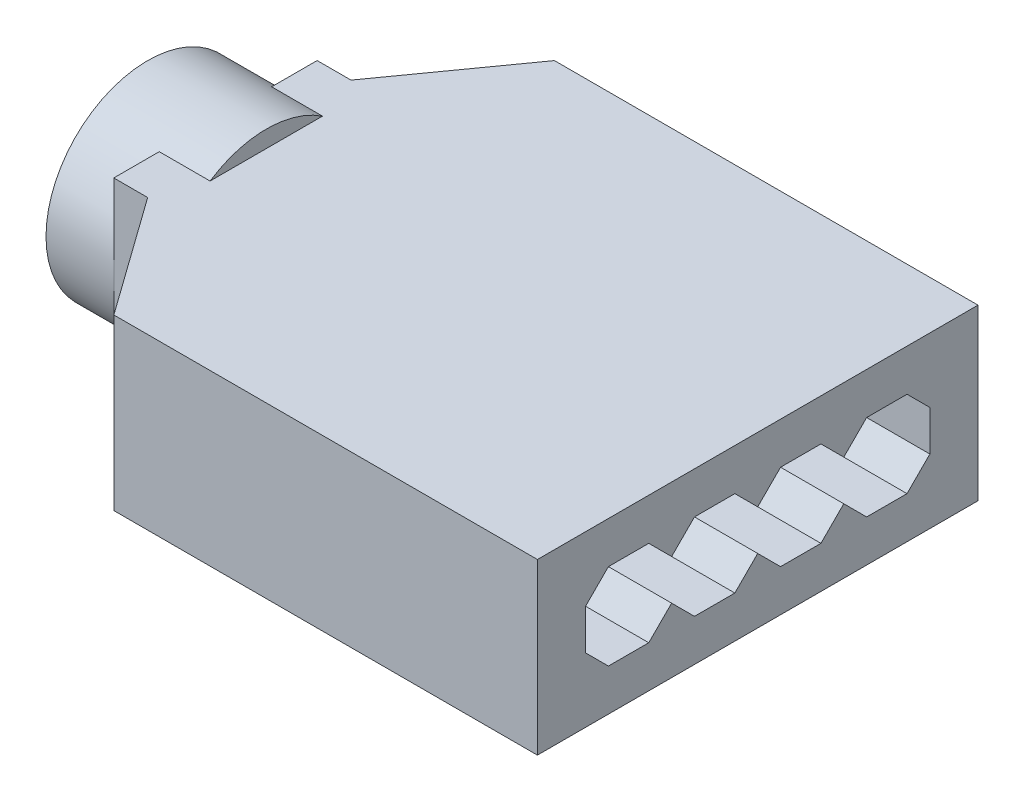
from build123d import *

# Parameters (mm, degrees)
CROQUIS1_W                     = 0.64
CROQUIS1_H                     = 0.64
SALIENTE_EXTRUIR1_DEPTH        = 2.54
SALIENTE_EXTRUIR2_DEPTH        = 8.54
SALIENTE_EXTRUIR2_DEPTH_BACK   = 3
CROQUIS3_W                     = 0.64
CROQUIS3_H                     = 0.64
SALIENTE_EXTRUIR2_2_DEPTH      = 8.54
SALIENTE_EXTRUIR2_2_DEPTH_BACK = 3
CHAFL_N1_SIZE                  = 0.2
CHAFL_N2_SIZE                  = 0.2
CROQUIS1_4_W                   = 11
CROQUIS1_4_H                   = 3
BOSS_EXTRUDE6_DEPTH            = 2.54
SKETCH6_W                      = 11
SKETCH6_H                      = 3
SKETCH6_R                      = 1
BOSS_EXTRUDE11_DEPTH           = 0.8
SKETCH7_W                      = 13
SKETCH7_H                      = 5
SKETCH7_W_2                    = 11
SKETCH7_H_2                    = 3
BOSS_EXTRUDE12_DEPTH           = 15
SKETCH8_W                      = 13
SKETCH8_H                      = 5
SKETCH8_R                      = 2
BOSS_EXTRUDE13_DEPTH           = 1
BOSS_EXTRUDE15_DEPTH           = 2
BOSS_EXTRUDE15_DEPTH_BACK      = 1.5
SKETCH9_R                      = 3
SKETCH9_R_2                    = 2
SKETCH10_W                     = 0.5
SKETCH10_H                     = 1.275200555
CUT_EXTRUDE2_DEPTH             = 3
BOSS_EXTRUDE20_DEPTH           = 3
CUT_EXTRUDE3_DEPTH             = 3
CUT_EXTRUDE5_DEPTH             = 18.878324866
CUT_EXTRUDE5_DEPTH_BACK        = 18.878324866


with BuildPart() as part:
    # Croquis1 → Saliente-Extruir1 (new body)
    # profile 1 of 2: a face of its own
    with BuildSketch(Plane(origin=(0, 0, 0), x_dir=(0, 0, -1), z_dir=(1, 0, 0))):
        Polygon((1.27, 0.595482683), (1.27, -0.595482683), (0.595482683, -1.27), (-0.595482683, -1.27), (-1.27, -0.595482683), (-1.27, 0.595482683), (-0.595482683, 1.27), (0.595482683, 1.27), align=None)
        Rectangle(CROQUIS1_W, CROQUIS1_H, mode=Mode.SUBTRACT)
    # profile 2 of 2: a face of its own
    with BuildSketch(Plane(origin=(0, 0, 0), x_dir=(0, 0, -1), z_dir=(1, 0, 0))):
        Polygon((3.135482683, 1.27), (3.81, 0.595482683), (3.81, -0.595482683), (3.135482683, -1.27), (1.944517317, -1.27), (1.27, -0.595482683), (1.27, 0.595482683), (1.944517317, 1.27), align=None)
        with Locations((2.54, 0)):
            Rectangle(CROQUIS1_W, CROQUIS1_H, mode=Mode.SUBTRACT)
    extrude(amount=SALIENTE_EXTRUIR1_DEPTH)

    # Mirror5: part across plane


with BuildPart() as body_2:
    # Croquis3 → Saliente-Extruir2 (new, two sides: drawn at the far end of the back side and taken through both)
    with BuildSketch(Plane(origin=(0, 0, 0), x_dir=(0, 0, -1), z_dir=(1, 0, 0)).offset(-SALIENTE_EXTRUIR2_DEPTH_BACK)):
        Rectangle(CROQUIS3_W, CROQUIS3_H)
    extrude(amount=SALIENTE_EXTRUIR2_DEPTH + SALIENTE_EXTRUIR2_DEPTH_BACK)

    # Chaflán1
    chafl_n1_edges = [body_2.edges().sort_by_distance(p)[0] for p in [
        (-3, 0, -0.32),
        (8.54, 0, 0.32),
        (8.54, -0.32, 0),
        (-3, 0.32, 0),
        (8.54, 0, -0.32),
        (8.54, 0.32, 0),
        (-3, 0, 0.32),
        (-3, -0.32, 0),
    ]]
    chamfer(chafl_n1_edges, length=CHAFL_N1_SIZE)


with BuildPart() as body_3:
    # Croquis3 → Saliente-Extruir2 2 (new, two sides: drawn at the far end of the back side and taken through both)
    with BuildSketch(Plane(origin=(0, 0, 0), x_dir=(0, 0, -1), z_dir=(1, 0, 0)).offset(-SALIENTE_EXTRUIR2_2_DEPTH_BACK)):
        with Locations((2.54, 0)):
            Rectangle(CROQUIS3_W, CROQUIS3_H)
    extrude(amount=SALIENTE_EXTRUIR2_2_DEPTH + SALIENTE_EXTRUIR2_2_DEPTH_BACK)

    # Chaflán2
    chafl_n2_edges = [body_3.edges().sort_by_distance(p)[0] for p in [
        (-3, 0, -2.86),
        (8.54, 0, -2.22),
        (8.54, -0.32, -2.54),
        (-3, 0.32, -2.54),
        (8.54, 0, -2.86),
        (8.54, 0.32, -2.54),
        (-3, 0, -2.22),
        (-3, -0.32, -2.54),
    ]]
    chamfer(chafl_n2_edges, length=CHAFL_N2_SIZE)


with BuildPart() as body_4:
    # Mirror3: mirrored copy
    add(body_2.part.mirror(Plane(origin=(2.54, 0, 1.27), x_dir=(1, 0, 0), z_dir=(0, 0, -1))))


with BuildPart() as body_5:
    # Mirror3 2: mirrored copy
    add(body_3.part.mirror(Plane(origin=(2.54, 0, 1.27), x_dir=(1, 0, 0), z_dir=(0, 0, -1))))


with BuildPart() as part_1:
    add(part.part)
    add(part.part.mirror(Plane(origin=(2.54, 0, 1.27), x_dir=(1, 0, 0), z_dir=(0, 0, -1))))


with BuildPart() as body_6:
    # Croquis1<4> → Boss-Extrude6 (new body)
    with BuildSketch(Plane(origin=(0, 0, 0), x_dir=(0, 0, -1), z_dir=(1, 0, 0))):
        with Locations((-1.27, 0)):
            Rectangle(CROQUIS1_4_W, CROQUIS1_4_H)
        Polygon((1.944517317, 1.27), (3.135482683, 1.27), (3.81, 0.595482683), (3.81, -0.595482683), (3.135482683, -1.27), (1.944517317, -1.27), (1.27, -0.595482683), (0.595482683, -1.27), (-0.595482683, -1.27), (-1.27, -0.595482683), (-1.27, 0.595482683), (-0.595482683, 1.27), (0.595482683, 1.27), (1.27, 0.595482683), align=None, mode=Mode.SUBTRACT)
    extrude(amount=BOSS_EXTRUDE6_DEPTH)

    # Combine5: cut body 2, body 3, body 4, body 5, part
    add(body_2.part, mode=Mode.SUBTRACT)
    add(body_3.part, mode=Mode.SUBTRACT)
    add(body_4.part, mode=Mode.SUBTRACT)
    add(body_5.part, mode=Mode.SUBTRACT)
    add(part_1.part, mode=Mode.SUBTRACT)

    # Sketch6 → Boss-Extrude11 (add)
    with BuildSketch(Plane.ZY):
        with Locations((1.27, 0)):
            Rectangle(SKETCH6_W, SKETCH6_H)
        with Locations((-2.54, 0)):
            Circle(SKETCH6_R, mode=Mode.SUBTRACT)
        with Locations((0, 0.013602928)):
            Circle(SKETCH6_R, mode=Mode.SUBTRACT)
        with Locations(Location((2.54, 0, 0), (0, 0, 180))):
            Circle(SKETCH6_R, mode=Mode.SUBTRACT)
        with Locations(Location((5.08, 0, 0), (0, 0, 180))):
            Circle(SKETCH6_R, mode=Mode.SUBTRACT)
    extrude(amount=BOSS_EXTRUDE11_DEPTH)

    # Sketch7 → Boss-Extrude12 (add)
    with BuildSketch(Plane(origin=(2.54, 0, 0), x_dir=(0, 0, -1), z_dir=(1, 0, 0))):
        with Locations((-1.27, 0)):
            Rectangle(SKETCH7_W, SKETCH7_H)
        with Locations((-1.27, 0)):
            Rectangle(SKETCH7_W_2, SKETCH7_H_2, mode=Mode.SUBTRACT)
    extrude(amount=-BOSS_EXTRUDE12_DEPTH)

    # Sketch8 → Boss-Extrude13 (add)
    with BuildSketch(Plane.ZY.offset(12.46)):
        with Locations((1.27, 0)):
            Rectangle(SKETCH8_W, SKETCH8_H)
        with Locations(Location((1.27, 0, 0), (0, 0, 131.409622109))):
            Circle(SKETCH8_R, mode=Mode.SUBTRACT)
    extrude(amount=BOSS_EXTRUDE13_DEPTH)

    # Sketch9 → Boss-Extrude15 (add, two sides: drawn at the far end of the back side and taken through both)
    with BuildSketch(Plane.ZY.offset(13.46).offset(-BOSS_EXTRUDE15_DEPTH_BACK)):
        with Locations(Location((1.27, 0, 0), (0, 0, 123.557309762))):
            Circle(SKETCH9_R)
        with Locations(Location((1.27, 0, 0), (0, 0, 131.409622109))):
            Circle(SKETCH9_R_2, mode=Mode.SUBTRACT)
    extrude(amount=BOSS_EXTRUDE15_DEPTH + BOSS_EXTRUDE15_DEPTH_BACK)

    # Sketch10 → Cut-Extrude2 (cut)
    with BuildSketch(Plane(origin=(0, -1.5, 0), x_dir=(1, 0, 0), z_dir=(0, 1, 0))):
        Polygon((-12.46, -3.868076211), (-12.46, -4.27), (-11.96, -4.27), (-10.789863612, -4.27), (-10.789863612, 1.73), (-12.46, 1.73), (-12.46, 1.328076211), (-11.96, 1.328076211), (-11.96, 0.052875656), (-12.46, 0.052875656), (-12.46, -2.592875656), (-11.96, -2.592875656), (-11.96, -3.868076211), align=None)
        with Locations((-12.21, -3.230475934)):
            Rectangle(SKETCH10_W, SKETCH10_H)
        with Locations((-12.21, 0.690475934)):
            Rectangle(SKETCH10_W, SKETCH10_H)
    extrude(amount=CUT_EXTRUDE2_DEPTH, mode=Mode.SUBTRACT)

    # Sketch15 → Boss-Extrude20 (add)
    with BuildSketch(Plane(origin=(-12.46, 0, 0), x_dir=(0, 0, -1), z_dir=(1, 0, 0))):
        with BuildLine():
            Line((4.23, -1.5), (4.23, 1.5))
            Line((4.23, 1.5), (0.052875656, 1.5))
            ThreePointArc((0.052875656, 1.5), (0.73, 0), (0.052875656, -1.5))
            Line((0.052875656, -1.5), (4.23, -1.5))
        make_face()
        with BuildLine():
            Line((-2.592875656, -1.5), (-6.77, -1.5))
            Line((-6.77, -1.5), (-6.77, 1.5))
            Line((-6.77, 1.5), (-2.592875656, 1.5))
            ThreePointArc((-2.592875656, 1.5), (-3.27, 0), (-2.592875656, -1.5))
        make_face()
    extrude(amount=BOSS_EXTRUDE20_DEPTH)

    # Sketch16 → Cut-Extrude3 (cut)
    with BuildSketch(Plane(origin=(0, 1.5, 0), x_dir=(1, 0, 0), z_dir=(0, 1, 0))):
        Polygon((-9.46, -2.592875656), (-12.46, -2.592875656), (-9.46, -6.77), align=None)
        Polygon((-12.46, 0.052875656), (-9.46, 4.23), (-9.46, 0.052875656), align=None)
    extrude(amount=-CUT_EXTRUDE3_DEPTH, mode=Mode.SUBTRACT)

    # Sketch19 → Cut-Extrude5 (cut, two sides: drawn at the far end of the back side and taken through both)
    with BuildSketch(Plane(origin=(0, 1.5, 0), x_dir=(1, 0, 0), z_dir=(0, 1, 0)).offset(-CUT_EXTRUDE5_DEPTH_BACK)):
        Polygon((-13.46, 5.23), (-9.957705311, 5.23), (-10.167106781, 4.937106781), (-12.46, 1.73), (-13.46, 1.73), align=None)
        Polygon((-13.46, -4.27), (-12.46, -4.27), (-10.167106781, -7.477106781), (-9.957705311, -7.77), (-13.46, -7.77), align=None)
    extrude(amount=CUT_EXTRUDE5_DEPTH + CUT_EXTRUDE5_DEPTH_BACK, mode=Mode.SUBTRACT)


solid = body_6.part
